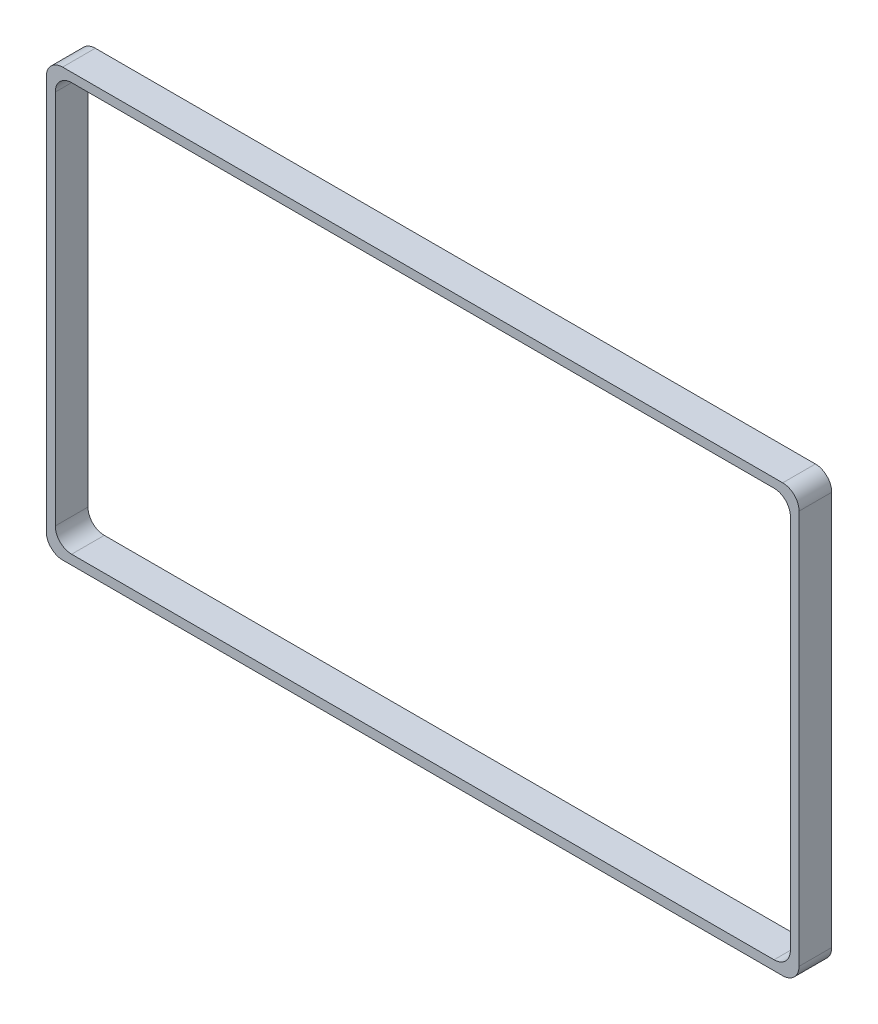
from build123d import *

# Parameters (mm, degrees)
SKETCH_2_W      = 4.608008283
SKETCH_2_H      = 2.613316436
SKETCH_2_W_2    = 4.5
SKETCH_2_H_2    = 2.5
EXTRUDE_1_DEPTH = 0.2
FILLET_1_R      = 0.1


with BuildPart() as part:
    # 草图2 → 凸台-拉伸1 (new body)
    with BuildSketch(Plane.XY):
        with Locations((-1.117645627, 1.306658218)):
            Rectangle(SKETCH_2_W, SKETCH_2_H)
        with Locations((-1.116666667, 1.308333333)):
            Rectangle(SKETCH_2_W_2, SKETCH_2_H_2, mode=Mode.SUBTRACT)
    extrude(amount=EXTRUDE_1_DEPTH)

    # 圆角1
    fillet_1_edges = [part.edges().sort_by_distance(p)[0] for p in [
        (-3.366666667, 0.058333333, 0.1),
        (1.133333333, 0.058333333, 0.1),
        (1.133333333, 2.558333333, 0.1),
        (-3.366666667, 2.558333333, 0.1),
        (1.186358514, 2.613316436, 0.1),
        (1.186358514, 0, 0.1),
        (-3.421649769, 0, 0.1),
        (-3.421649769, 2.613316436, 0.1),
    ]]
    fillet(fillet_1_edges, radius=FILLET_1_R)


solid = part.part
